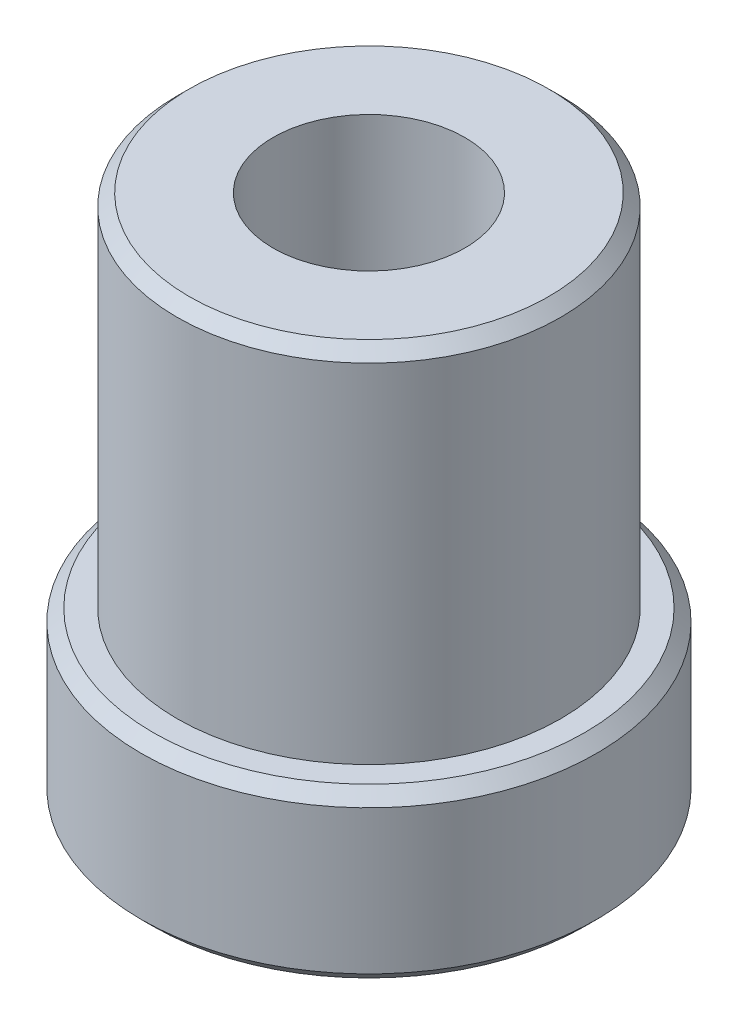
from build123d import *

# Parameters (mm, degrees)
SKETCH1_R           = 9.5
BOSS_EXTRUDE1_DEPTH = 7
SKETCH2_R           = 8
BOSS_EXTRUDE2_DEPTH = 15
SKETCH3_R           = 4
CUT_EXTRUDE1_DEPTH  = 26.777897509
CHAMFER1_SIZE       = 0.5


with BuildPart() as part:
    # Sketch1 → Boss-Extrude1 (new body)
    with BuildSketch(Plane(origin=(0, 0, 0), x_dir=(1, 0, 0), z_dir=(0, 1, 0))):
        with Locations(Location((0, 0, 0), (0, 0, 270))):
            Circle(SKETCH1_R)
    extrude(amount=BOSS_EXTRUDE1_DEPTH)

    # Sketch2 → Boss-Extrude2 (add)
    with BuildSketch(Plane(origin=(0, 7, 0), x_dir=(1, 0, 0), z_dir=(0, 1, 0))):
        with Locations(Location((0, 0, 0), (0, 0, 270))):
            Circle(SKETCH2_R)
    extrude(amount=BOSS_EXTRUDE2_DEPTH)

    # Sketch3 → Cut-Extrude1 (cut, through all)
    with BuildSketch(Plane(origin=(0, 22, 0), x_dir=(1, 0, 0), z_dir=(0, 1, 0))):
        with Locations(Location((0, 0, 0), (0, 0, 270))):
            Circle(SKETCH3_R)
    extrude(amount=-CUT_EXTRUDE1_DEPTH, mode=Mode.SUBTRACT)

    # Chamfer1
    chamfer1_edges = [part.edges().sort_by_distance(p)[0] for p in [
        (0, 0, -9.5),
        (0, 7, -9.5),
        (0, 22, -8),
    ]]
    chamfer(chamfer1_edges, length=CHAMFER1_SIZE)


solid = part.part
